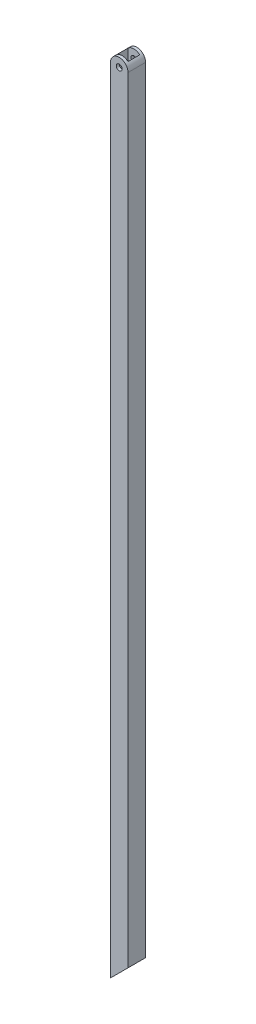
from build123d import *

# Parameters (mm, degrees)
ESQUISSE1_R             = 3.175
BOSS_EXTRU_1_DEPTH      = 19.05
ESQUISSE2_W             = 12.7
ESQUISSE2_H             = 12.7
ENL_V_MAT_EXTRU_3_DEPTH = 871.41702936


with BuildPart() as part:
    # Esquisse1 → Boss.-Extru.1 (new body)
    with BuildSketch(Plane.XY):
        with BuildLine():
            Line((0, 0), (19.05, 19.05))
            Line((19.05, 19.05), (19.05, 860.475))
            ThreePointArc((19.05, 860.475), (9.525, 870), (0, 860.475))
            Line((0, 860.475), (0, 0))
        make_face()
        with Locations(Location((9.525, 860.475, 0), (0, 0, 180))):
            Circle(ESQUISSE1_R, mode=Mode.SUBTRACT)
    extrude(amount=BOSS_EXTRU_1_DEPTH)

    # Esquisse2 → Enlèv. mat.-Extru.3 (cut, through all)
    with BuildSketch(Plane(origin=(0, 0, 0), x_dir=(1, 0, 0), z_dir=(0, 1, 0))):
        with Locations((9.525, -9.525)):
            Rectangle(ESQUISSE2_W, ESQUISSE2_H)
    extrude(amount=ENL_V_MAT_EXTRU_3_DEPTH, mode=Mode.SUBTRACT)


solid = part.part
